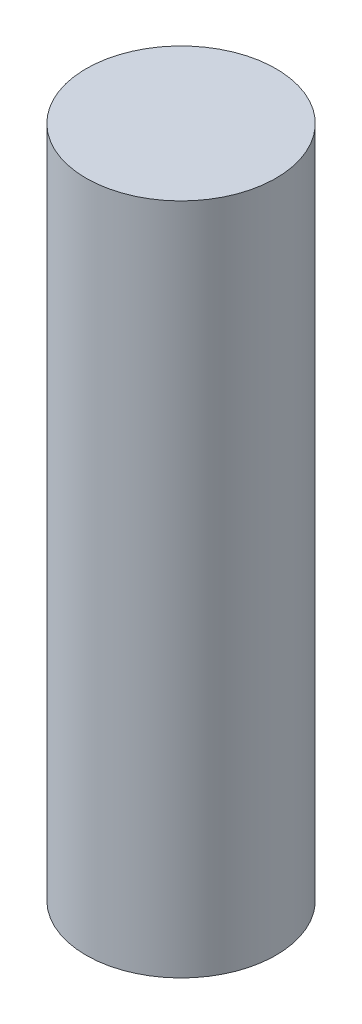
from build123d import *

# Parameters (mm, degrees)
SKETCH_1_R      = 4.5
EXTRUDE_1_DEPTH = 31.9


with BuildPart() as part:
    # 草图1 → 凸台-拉伸1 (new body)
    with BuildSketch(Plane(origin=(0, 0, 0), x_dir=(1, 0, 0), z_dir=(0, 1, 0))):
        with Locations(Location((0, 0, 0), (0, 0, 270))):
            Circle(SKETCH_1_R)
    extrude(amount=EXTRUDE_1_DEPTH)


solid = part.part
